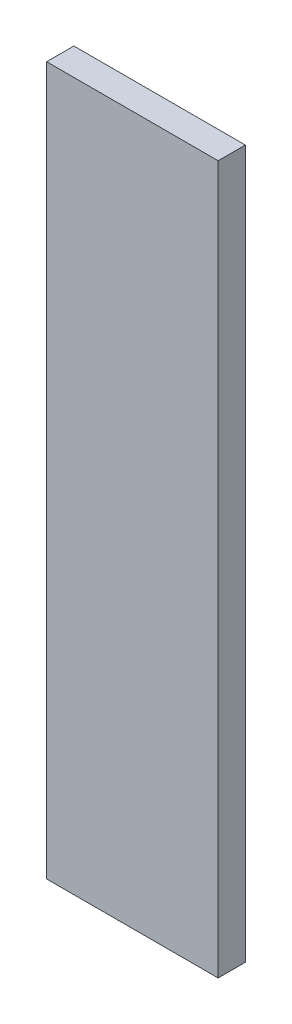
from build123d import *

# Parameters (mm, degrees)
SKETCH1_W           = 16.002
SKETCH1_H           = 66.04
BOSS_EXTRUDE2_DEPTH = 2.54


with BuildPart() as part:
    # Sketch1 → Boss-Extrude2 (new body)
    with BuildSketch(Plane.XY):
        with Locations((8.001, 33.02)):
            Rectangle(SKETCH1_W, SKETCH1_H)
    extrude(amount=BOSS_EXTRUDE2_DEPTH)


solid = part.part
